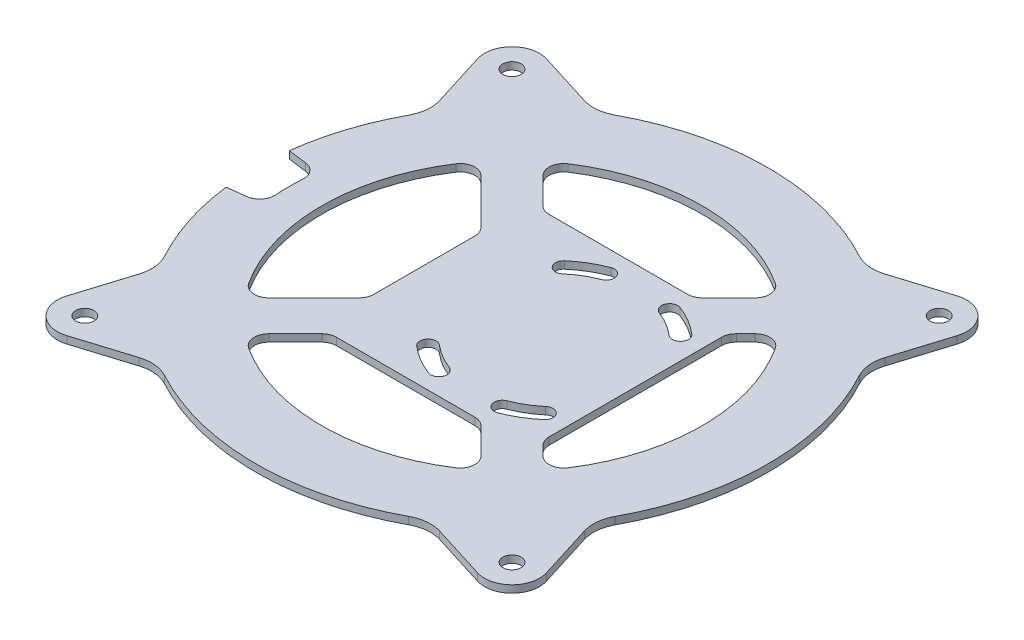
from build123d import *

# Parameters (mm, degrees)
SKETCH_1_R      = 1.25
EXTRUDE_1_DEPTH = 1


with BuildPart() as part:
    # 草图1 → 凸台-拉伸1 (new body)
    with BuildSketch(Plane(origin=(0, 0, 0), x_dir=(1, 0, 0), z_dir=(0, 1, 0))):
        with BuildLine():
            Line((30.403196742, 20.530472404), (32.748196125, 28.051999014))
            ThreePointArc((32.748196125, 28.051999014), (31.819805153, 31.819805153), (28.051999014, 32.748196125))
            Line((28.051999014, 32.748196125), (20.530472404, 30.403196742))
            ThreePointArc((20.530472404, 30.403196742), (18.558164611, 30.200075754), (16.661981691, 30.779512116))
            ThreePointArc((16.661981691, 30.779512116), (8.59409902, 33.928475681), (0, 35))
            ThreePointArc((0, 35), (-8.59409902, 33.928475681), (-16.661981691, 30.779512116))
            ThreePointArc((-16.661981691, 30.779512116), (-18.558164611, 30.200075754), (-20.530472404, 30.403196742))
            Line((-20.530472404, 30.403196742), (-28.051999014, 32.748196125))
            ThreePointArc((-28.051999014, 32.748196125), (-31.819805153, 31.819805153), (-32.748196125, 28.051999014))
            Line((-32.748196125, 28.051999014), (-30.403196742, 20.530472404))
            ThreePointArc((-30.403196742, 20.530472404), (-30.200075754, 18.558164611), (-30.779512116, 16.661981691))
            ThreePointArc((-30.779512116, 16.661981691), (-33.33279353, 10.673559644), (-34.732884242, 4.315872125))
            Line((-34.732884242, 4.315872125), (-32.190837206, 4))
            ThreePointArc((-32.190837206, 4), (-30.89823255, 3.292285123), (-30.441307179, 1.891247526))
            ThreePointArc((-30.441307179, 1.891247526), (-30.5, 0), (-30.441307179, -1.891247526))
            ThreePointArc((-30.441307179, -1.891247526), (-30.89823255, -3.292285123), (-32.190837206, -4))
            Line((-32.190837206, -4), (-34.732884242, -4.315872125))
            ThreePointArc((-34.732884242, -4.315872125), (-33.33279353, -10.673559644), (-30.779512116, -16.661981691))
            ThreePointArc((-30.779512116, -16.661981691), (-30.200075754, -18.558164611), (-30.403196742, -20.530472404))
            Line((-30.403196742, -20.530472404), (-32.748196125, -28.051999014))
            ThreePointArc((-32.748196125, -28.051999014), (-31.819805153, -31.819805153), (-28.051999014, -32.748196125))
            Line((-28.051999014, -32.748196125), (-20.530472404, -30.403196742))
            ThreePointArc((-20.530472404, -30.403196742), (-18.558164611, -30.200075754), (-16.661981691, -30.779512116))
            ThreePointArc((-16.661981691, -30.779512116), (-8.59409902, -33.928475681), (0, -35))
            ThreePointArc((0, -35), (8.59409902, -33.928475681), (16.661981691, -30.779512116))
            ThreePointArc((16.661981691, -30.779512116), (18.558164611, -30.200075754), (20.530472404, -30.403196742))
            Line((20.530472404, -30.403196742), (28.051999014, -32.748196125))
            ThreePointArc((28.051999014, -32.748196125), (31.819805153, -31.819805153), (32.748196125, -28.051999014))
            Line((32.748196125, -28.051999014), (30.403196742, -20.530472404))
            ThreePointArc((30.403196742, -20.530472404), (30.200075754, -18.558164611), (30.779512116, -16.661981691))
            ThreePointArc((30.779512116, -16.661981691), (33.928475681, -8.59409902), (35, 0))
            ThreePointArc((35, 0), (33.928475681, 8.59409902), (30.779512116, 16.661981691))
            ThreePointArc((30.779512116, 16.661981691), (30.200075754, 18.558164611), (30.403196742, 20.530472404))
        make_face()
        with Locations(Location((-29.168154724, -29.168154724, 0), (0, 0, 270))):
            Circle(SKETCH_1_R, mode=Mode.SUBTRACT)
        with BuildLine():
            Line((-14.476872329, -18.719513016), (-10.868928268, -15.111568955))
            ThreePointArc((-10.868928268, -15.111568955), (-10.22008157, -14.678023452), (-9.454714705, -14.525782517))
            Line((-9.454714705, -14.525782517), (9.454714705, -14.525782517))
            ThreePointArc((9.454714705, -14.525782517), (10.22008157, -14.678023452), (10.868928268, -15.111568955))
            Line((10.868928268, -15.111568955), (14.476872329, -18.719513016))
            ThreePointArc((14.476872329, -18.719513016), (15.051657451, -20.343212221), (14.151213664, -21.811537127))
            ThreePointArc((14.151213664, -21.811537127), (0, -26), (-14.151213664, -21.811537127))
            ThreePointArc((-14.151213664, -21.811537127), (-15.051657451, -20.343212221), (-14.476872329, -18.719513016))
        make_face(mode=Mode.SUBTRACT)
        with BuildLine():
            ThreePointArc((1.828205899, -10.397220329), (2.466819597, -11.815731007), (1.048308919, -12.454344705))
            ThreePointArc((1.048308919, -12.454344705), (-1.042632246, -11.445222173), (-2.926575027, -10.088342356))
            ThreePointArc((-2.926575027, -10.088342356), (-3.041516382, -8.536959591), (-1.490133616, -8.422018236))
            ThreePointArc((-1.490133616, -8.422018236), (0.082632246, -9.554777827), (1.828205899, -10.397220329))
        make_face(mode=Mode.SUBTRACT)
        with Locations(Location((29.168154724, -29.168154724, 0), (0, 0, 270))):
            Circle(SKETCH_1_R, mode=Mode.SUBTRACT)
        with BuildLine():
            ThreePointArc((14.466575027, -10.088342356), (12.582632246, -11.445222173), (10.491691081, -12.454344705))
            ThreePointArc((10.491691081, -12.454344705), (9.073180403, -11.815731007), (9.711794101, -10.397220329))
            ThreePointArc((9.711794101, -10.397220329), (11.457367754, -9.554777827), (13.030133616, -8.422018236))
            ThreePointArc((13.030133616, -8.422018236), (14.581516382, -8.536959591), (14.466575027, -10.088342356))
        make_face(mode=Mode.SUBTRACT)
        with BuildLine():
            Line((-11.97, 6.898932188), (-11.97, -6.898932188))
            ThreePointArc((-11.97, -6.898932188), (-12.122240935, -7.664299053), (-12.555786438, -8.313145751))
            Line((-12.555786438, -8.313145751), (-18.719513016, -14.476872329))
            ThreePointArc((-18.719513016, -14.476872329), (-20.343212221, -15.051657451), (-21.811537127, -14.151213664))
            ThreePointArc((-21.811537127, -14.151213664), (-26, 0), (-21.811537127, 14.151213664))
            ThreePointArc((-21.811537127, 14.151213664), (-20.343212221, 15.051657451), (-18.719513016, 14.476872329))
            Line((-18.719513016, 14.476872329), (-12.555786438, 8.313145751))
            ThreePointArc((-12.555786438, 8.313145751), (-12.122240935, 7.664299053), (-11.97, 6.898932188))
        make_face(mode=Mode.SUBTRACT)
        with BuildLine():
            ThreePointArc((-2.926575027, 10.088342356), (-1.042632246, 11.445222173), (1.048308919, 12.454344705))
            ThreePointArc((1.048308919, 12.454344705), (2.466819597, 11.815731007), (1.828205899, 10.397220329))
            ThreePointArc((1.828205899, 10.397220329), (0.082632246, 9.554777827), (-1.490133616, 8.422018236))
            ThreePointArc((-1.490133616, 8.422018236), (-3.041516382, 8.536959591), (-2.926575027, 10.088342356))
        make_face(mode=Mode.SUBTRACT)
        with Locations(Location((-29.168154724, 29.168154724, 0), (0, 0, 270))):
            Circle(SKETCH_1_R, mode=Mode.SUBTRACT)
        with BuildLine():
            ThreePointArc((10.868928268, 15.111568955), (10.22008157, 14.678023452), (9.454714705, 14.525782517))
            Line((9.454714705, 14.525782517), (-9.454714705, 14.525782517))
            ThreePointArc((-9.454714705, 14.525782517), (-10.22008157, 14.678023452), (-10.868928268, 15.111568955))
            Line((-10.868928268, 15.111568955), (-14.476872329, 18.719513016))
            ThreePointArc((-14.476872329, 18.719513016), (-15.051657451, 20.343212221), (-14.151213664, 21.811537127))
            ThreePointArc((-14.151213664, 21.811537127), (0, 26), (14.151213664, 21.811537127))
            ThreePointArc((14.151213664, 21.811537127), (15.051657451, 20.343212221), (14.476872329, 18.719513016))
            Line((14.476872329, 18.719513016), (10.868928268, 15.111568955))
        make_face(mode=Mode.SUBTRACT)
        with BuildLine():
            ThreePointArc((9.711794101, 10.397220329), (9.073180403, 11.815731007), (10.491691081, 12.454344705))
            ThreePointArc((10.491691081, 12.454344705), (12.582632246, 11.445222173), (14.466575027, 10.088342356))
            ThreePointArc((14.466575027, 10.088342356), (14.581516382, 8.536959591), (13.030133616, 8.422018236))
            ThreePointArc((13.030133616, 8.422018236), (11.457367754, 9.554777827), (9.711794101, 10.397220329))
        make_face(mode=Mode.SUBTRACT)
        with BuildLine():
            ThreePointArc((21.811537127, -14.151213664), (20.343212221, -15.051657451), (18.719513016, -14.476872329))
            Line((18.719513016, -14.476872329), (17.434140759, -13.191500072))
            ThreePointArc((17.434140759, -13.191500072), (17.000595257, -12.542653375), (16.848354322, -11.77728651))
            Line((16.848354322, -11.77728651), (16.848354322, 11.77728651))
            ThreePointArc((16.848354322, 11.77728651), (17.000595257, 12.542653375), (17.434140759, 13.191500072))
            Line((17.434140759, 13.191500072), (18.719513016, 14.476872329))
            ThreePointArc((18.719513016, 14.476872329), (20.343212221, 15.051657451), (21.811537127, 14.151213664))
            ThreePointArc((21.811537127, 14.151213664), (26, 0), (21.811537127, -14.151213664))
        make_face(mode=Mode.SUBTRACT)
        with Locations(Location((29.168154724, 29.168154724, 0), (0, 0, 270))):
            Circle(SKETCH_1_R, mode=Mode.SUBTRACT)
    extrude(amount=EXTRUDE_1_DEPTH)


solid = part.part
